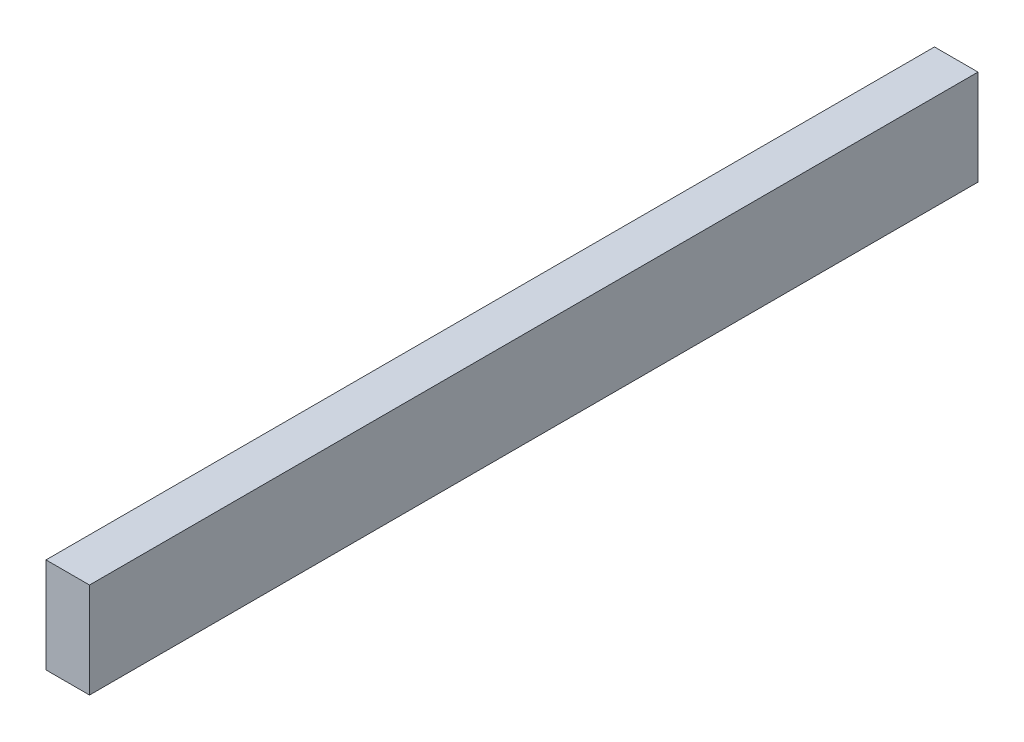
from build123d import *

# Parameters (mm, degrees)
SKETCH1_W           = 6.858
SKETCH1_H           = 15.02
BOSS_EXTRUDE1_DEPTH = 70


with BuildPart() as part:
    # Sketch1 → Boss-Extrude1 (new, symmetric)
    with BuildSketch(Plane.XY):
        Rectangle(SKETCH1_W, SKETCH1_H)
    extrude(amount=BOSS_EXTRUDE1_DEPTH, both=True)


solid = part.part
